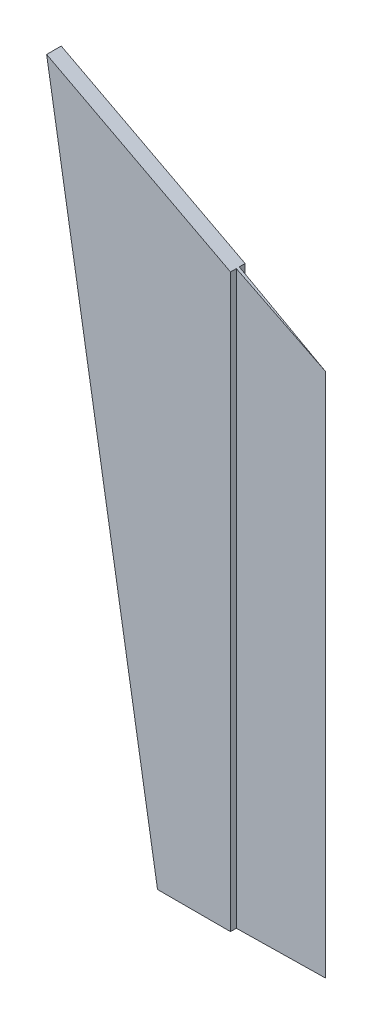
from build123d import *

# Parameters (mm, degrees)
EXTRUDE_1_DEPTH     = 5
CUT_EXTRUDE_2_DEPTH = 200


with BuildPart() as part:
    # 草图1 → 凸台-拉伸1 (new body)
    with BuildSketch(Plane.XY):
        Polygon((-7.259084377, -114.381441925), (-45.249305145, 114.381441925), (47.740915623, 65.618558075), (47.740915623, -114.381441925), align=None)
    extrude(amount=EXTRUDE_1_DEPTH)

    # 草图2 → 切除-拉伸2 (cut)
    with BuildSketch(Plane.XZ.offset(114.381441925)):
        Polygon((17.740915623, 5), (47.740915623, 5.362068385), (52.130743892, 0.972240116), (47.740915623, -0.81389846), (17.740915623, 0), (17.740915623, 1.999597824), (47.740915623, 2.5), (17.740915623, 3.000402176), align=None)
        Polygon((47.740915623, 35.362068385), (52.130743892, 30.972240116), (47.740915623, 29.18610154), (17.740915623, 30), (17.740915623, 31.999597824), (47.740915623, 32.5), (17.740915623, 33.000402176), (17.740915623, 35), align=None)
    extrude(amount=-CUT_EXTRUDE_2_DEPTH, mode=Mode.SUBTRACT)


solid = part.part
